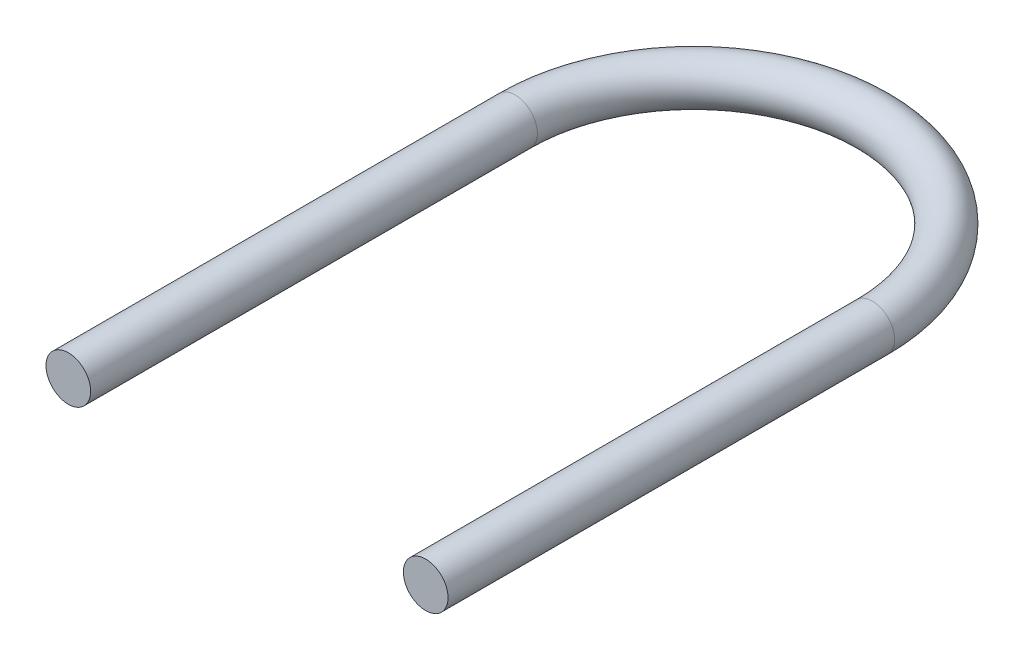
from build123d import *

# Parameters (mm, degrees)
SKETCH1_R = 12.7


with BuildPart() as part:
    # Sweep2: sweep along a path in Sketch2
    with BuildLine(Plane(origin=(0, 0, 0), x_dir=(1, 0, 0), z_dir=(0, 1, 0))) as sweep2_path:
        Line((0, 0), (0, 254))
        ThreePointArc((0, 254), (101.6, 355.6), (203.2, 254))
        Line((203.2, 254), (203.2, 0))
    # Sketch1 → Sweep2 (sweep)
    with BuildSketch(Plane.XY):
        Circle(SKETCH1_R)
    sweep(path=sweep2_path.line)


solid = part.part
